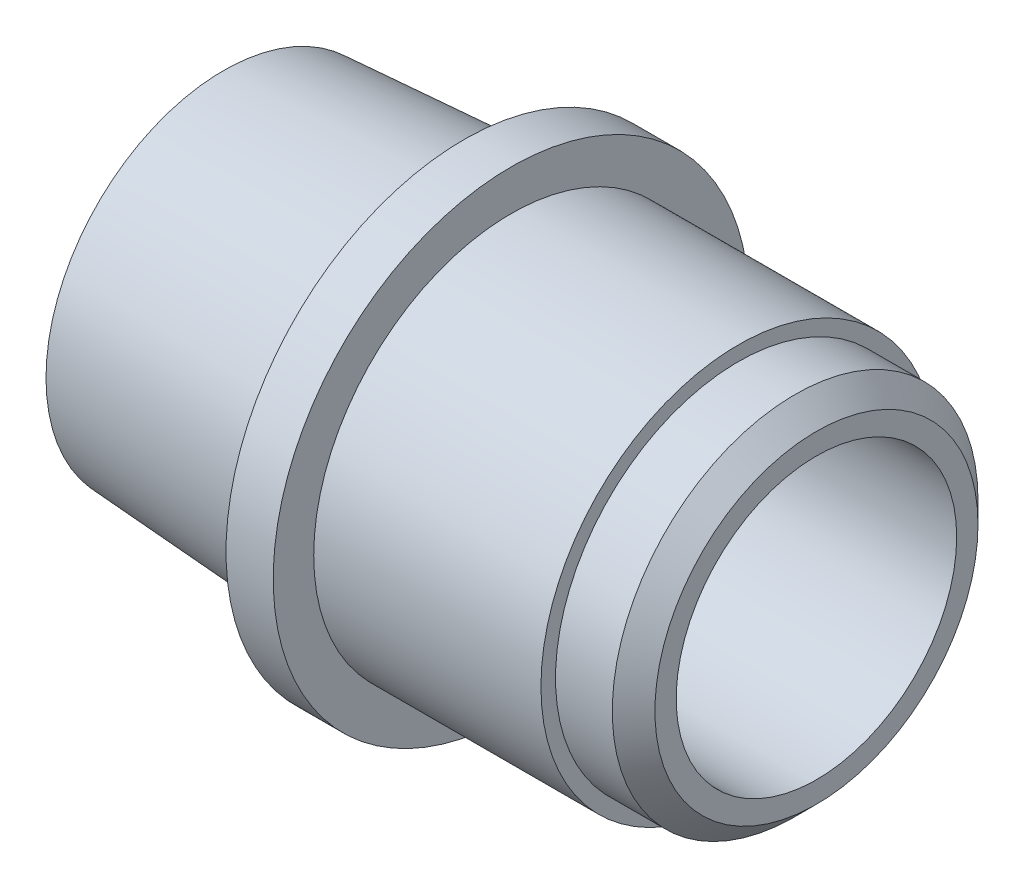
from build123d import *

# Parameters (mm, degrees)
SKETCH3_R      = 6.35
SKETCH5_R      = 6.8961
SKETCH7_R      = 5.0165
EXTRUDE2_DEPTH = 20.066


with BuildPart() as part:
    # Sketch2 → Revolve1 (revolve)
    with BuildSketch(Plane.XY, mode=Mode.PRIVATE) as revolve1_sk:
        Polygon((18.415, 1.9685), (20.447, 1.9685), (21.209, 2.7305), (21.209, 8.509), (8.5979, 8.509), (8.5979, 1.524), (8.5979, 0), (10.287, 0), (10.287, 1.4478), (18.415, 1.4478), align=None)
    revolve(revolve1_sk.sketch.rotate(Axis((21.209, 8.509, 0), (-1, 0, 0)), 270), axis=Axis((21.209, 8.509, 0), (-1, 0, 0)))

    # Sketch3 → Loft2 section 0
    with BuildSketch(Plane(origin=(0, 0, 0), x_dir=(0, 0, -1), z_dir=(1, 0, 0))):
        with Locations((0, 8.509)):
            Circle(SKETCH3_R)
    # Sketch5 → Loft2 section 1
    with BuildSketch(Plane(origin=(8.636, 0, 0), x_dir=(0, 0, -1), z_dir=(1, 0, 0))):
        with Locations((0, 8.509)):
            Circle(SKETCH5_R)
    loft()

    # Sketch7 → Extrude2 (cut)
    with BuildSketch(Plane(origin=(21.209, 0, 0), x_dir=(0, 0, -1), z_dir=(1, 0, 0))):
        with Locations((0, 8.509)):
            Circle(SKETCH7_R)
    extrude(amount=-EXTRUDE2_DEPTH, mode=Mode.SUBTRACT)


solid = part.part
